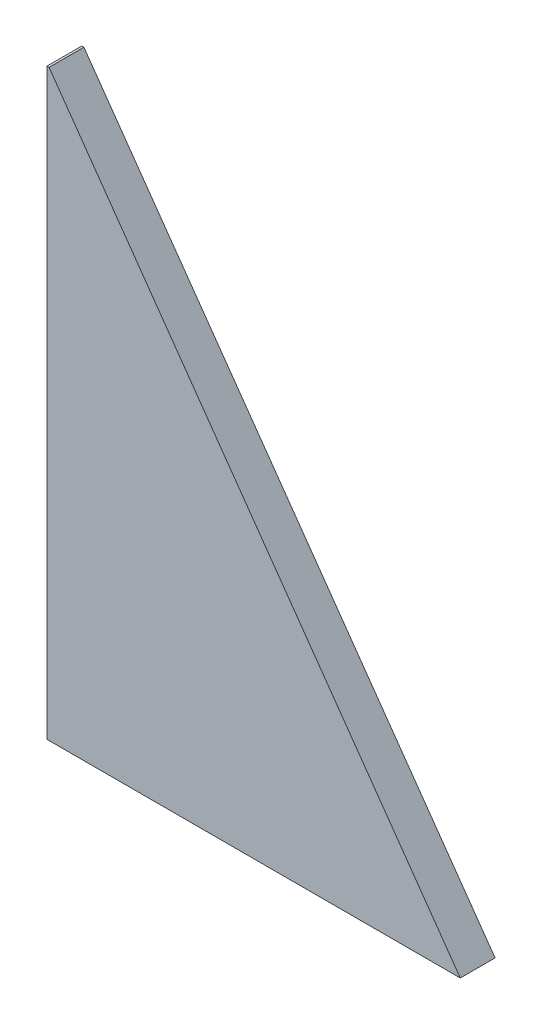
from build123d import *

# Parameters (mm, degrees)
EXTRUDE_1_DEPTH = 16


with BuildPart() as part:
    # 草图1 → 凸台-拉伸1 (new body)
    with BuildSketch(Plane.XY):
        Polygon((0, 0), (0, 268), (1, 268), (190, 0), align=None)
    extrude(amount=EXTRUDE_1_DEPTH)


solid = part.part
